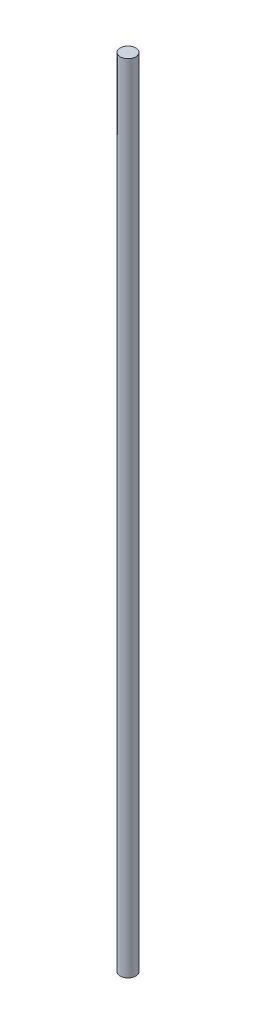
from build123d import *

# Parameters (mm, degrees)
SKETCH1_R           = 4
BOSS_EXTRUDE1_DEPTH = 410


with BuildPart() as part:
    # Sketch1 → Boss-Extrude1 (new body)
    with BuildSketch(Plane(origin=(0, 0, 0), x_dir=(1, 0, 0), z_dir=(0, 1, 0))):
        with Locations(Location((0, 0, 0), (0, 0, 90))):
            Circle(SKETCH1_R)
    extrude(amount=BOSS_EXTRUDE1_DEPTH)


solid = part.part
